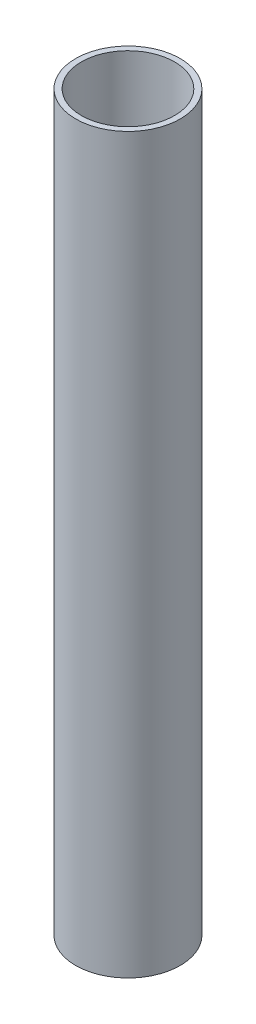
from build123d import *

# Parameters (mm, degrees)
SKETCH1_R           = 14.5
SKETCH1_R_2         = 12.9125
BOSS_EXTRUDE1_DEPTH = 101.6


with BuildPart() as part:
    # Sketch1 → Boss-Extrude1 (new, symmetric)
    with BuildSketch(Plane(origin=(0, 0, 0), x_dir=(1, 0, 0), z_dir=(0, 1, 0))):
        with Locations(Location((0, 0, 0), (0, 0, 270))):
            Circle(SKETCH1_R)
        with Locations(Location((0, 0, 0), (0, 0, 270))):
            Circle(SKETCH1_R_2, mode=Mode.SUBTRACT)
    extrude(amount=BOSS_EXTRUDE1_DEPTH, both=True)


solid = part.part
